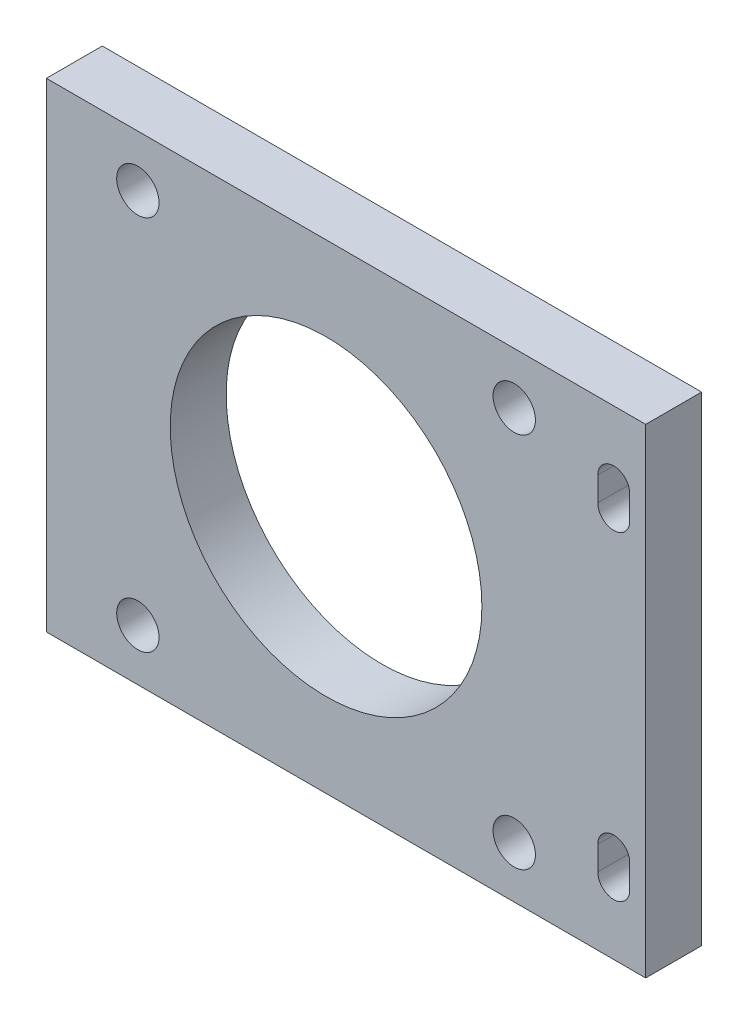
from build123d import *

# Parameters (mm, degrees)
SKETCH1_W                  = 75
SKETCH1_H                  = 60
BOSS_EXTRUDE1_DEPTH        = 7
F_5_3_5_3_DIAMETER_HOLE1_D = 5.3
F_10_0_10_DIAMETER_HOLE1_D = 10
SKETCH5_R                  = 19.5
CUT_EXTRUDE1_DEPTH         = 49.53091798
CUT_EXTRUDE2_DEPTH         = 49.53091798


with BuildPart() as part:
    # Sketch1 → Boss-Extrude1 (new body)
    with BuildSketch(Plane.XY):
        Rectangle(SKETCH1_W, SKETCH1_H)
    extrude(amount=BOSS_EXTRUDE1_DEPTH)

    # Ø5.3 (5.3) Diameter Hole1 (through all)
    with Locations(Plane(origin=(21.05, 23.55, 0), x_dir=(-1, 0, 0), z_dir=(0, 0, -1))):
        with Locations((0, 0), (47.1, 0), (47.1, -47.1), (0, -47.1)):
            Hole(F_5_3_5_3_DIAMETER_HOLE1_D / 2)

    # Ø10.0 (10) Diameter Hole1 (through all)
    with Locations(Plane(origin=(-2.5, 0, 0), x_dir=(-1, 0, 0), z_dir=(0, 0, -1))):
        with Locations((0, 0)):
            Hole(F_10_0_10_DIAMETER_HOLE1_D / 2)

    # Sketch5 → Cut-Extrude1 (cut, through all)
    with BuildSketch(Plane.XY.offset(7)):
        with Locations((-2.5, 0)):
            Circle(SKETCH5_R)
    extrude(amount=-CUT_EXTRUDE1_DEPTH, mode=Mode.SUBTRACT)

    # Sketch6 → Cut-Extrude2 (cut, through all)
    with BuildSketch(Plane(origin=(0, 0, 0), x_dir=(-1, 0, 0), z_dir=(0, 0, -1))):
        with BuildLine():
            Line((-35.5, 18.5), (-35.5, 21.5))
            ThreePointArc((-35.5, 21.5), (-33.5, 23.5), (-31.5, 21.5))
            Line((-31.5, 21.5), (-31.5, 18.5))
            ThreePointArc((-31.5, 18.5), (-33.5, 16.5), (-35.5, 18.5))
        make_face()
        with BuildLine():
            Line((-35.5, -18.5), (-35.5, -21.5))
            ThreePointArc((-35.5, -21.5), (-33.5, -23.5), (-31.5, -21.5))
            Line((-31.5, -21.5), (-31.5, -18.5))
            ThreePointArc((-31.5, -18.5), (-33.5, -16.5), (-35.5, -18.5))
        make_face()
    extrude(amount=-CUT_EXTRUDE2_DEPTH, mode=Mode.SUBTRACT)


solid = part.part
